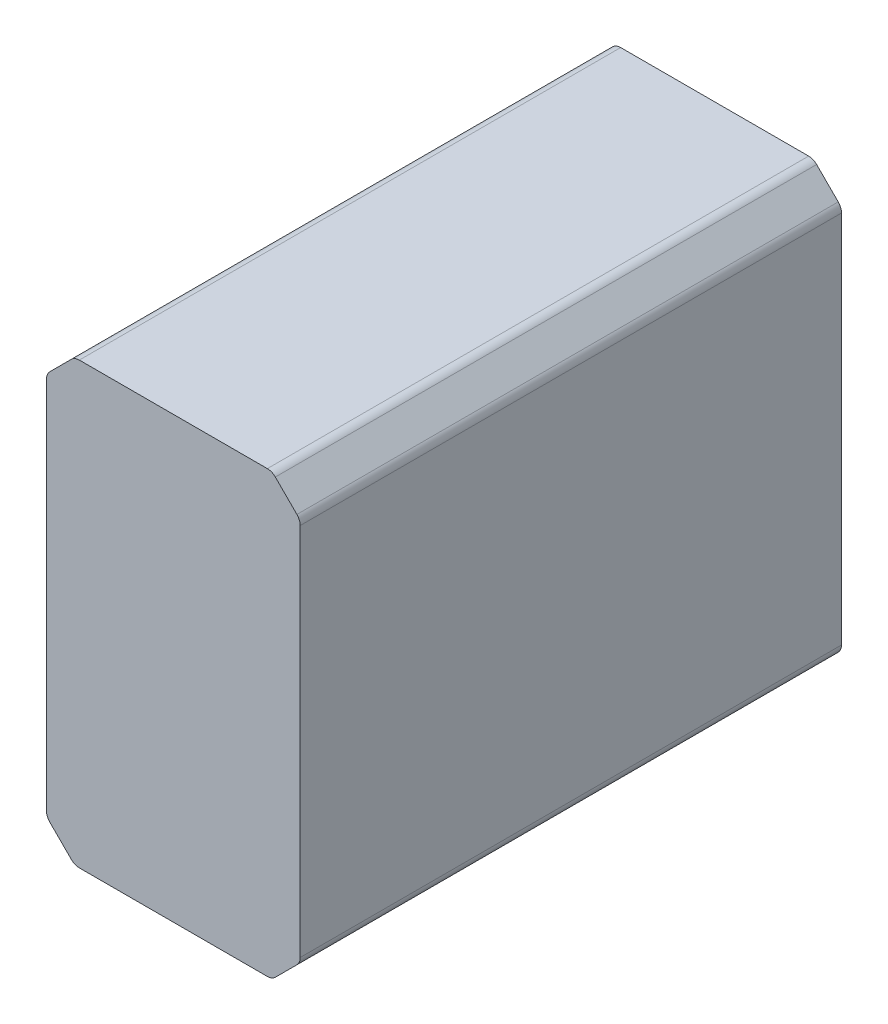
from build123d import *

# Parameters (mm, degrees)
SKETCH_1_W      = 90
SKETCH_1_H      = 156
EXTRUDE_1_DEPTH = 192
CHAMFER_1_SIZE  = 10
FILLET_1_R      = 4


with BuildPart() as part:
    # 草图1 → 凸台-拉伸1 (new body)
    with BuildSketch(Plane.XY):
        with Locations((45, -78)):
            Rectangle(SKETCH_1_W, SKETCH_1_H)
    extrude(amount=EXTRUDE_1_DEPTH)

    # 倒角1
    chamfer_1_edges = [part.edges().sort_by_distance(p)[0] for p in [
        (0, 0, 96),
        (90, 0, 96),
        (90, -156, 96),
        (0, -156, 96),
    ]]
    chamfer(chamfer_1_edges, length=CHAMFER_1_SIZE)

    # 圆角1
    fillet_1_edges = [part.edges().sort_by_distance(p)[0] for p in [
        (80, -156, 96),
        (10, -156, 96),
        (0, -10, 96),
        (0, -146, 96),
        (90, -10, 96),
        (90, -146, 96),
        (80, 0, 96),
        (10, 0, 96),
    ]]
    fillet(fillet_1_edges, radius=FILLET_1_R)


solid = part.part
